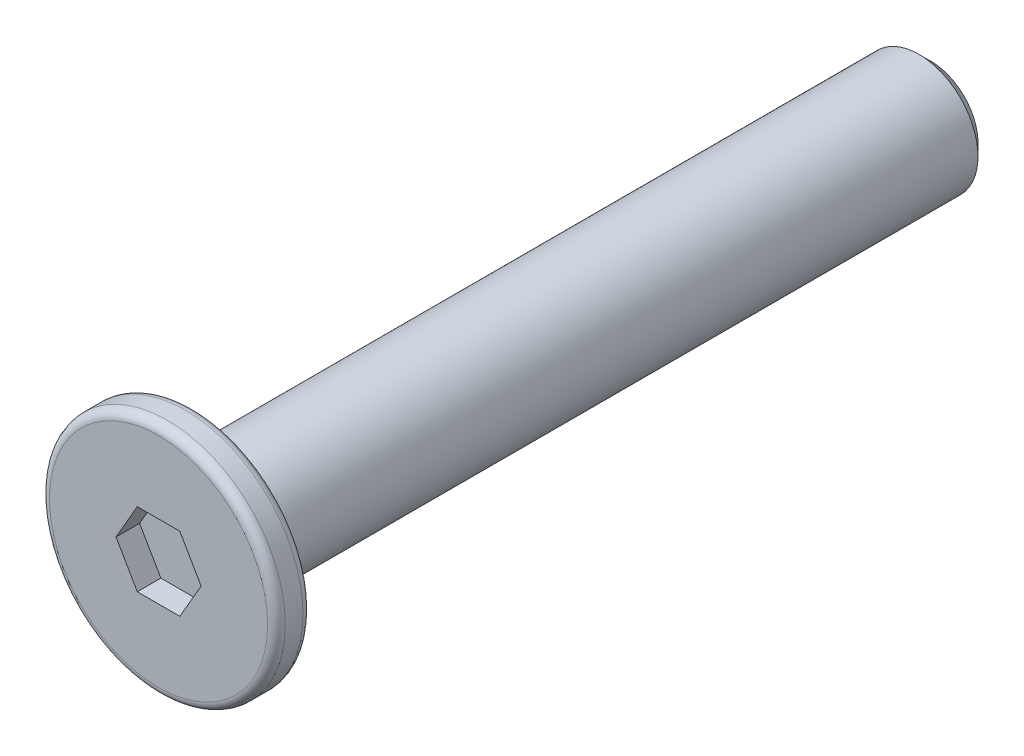
from build123d import *

# Parameters (mm, degrees)
SKETCH_1_R          = 4
EXTRUDE_1_DEPTH     = 0.6
SKETCH_2_R          = 2
EXTRUDE_2_DEPTH     = 25
CHAMFER_1_SIZE      = 0.4
CUT_EXTRUDE_1_DEPTH = 0.8
FILLET_2_R          = 0.3


with BuildPart() as part:
    # 草图1 → 凸台-拉伸1 (new, symmetric)
    with BuildSketch(Plane.XY):
        Circle(SKETCH_1_R)
    extrude(amount=EXTRUDE_1_DEPTH, both=True)

    # 草图2 → 凸台-拉伸2 (add)
    with BuildSketch(Plane(origin=(0, 0, -0.6), x_dir=(-1, 0, 0), z_dir=(0, 0, -1))):
        Circle(SKETCH_2_R)
    extrude(amount=EXTRUDE_2_DEPTH)

    # 倒角1
    chamfer_1_edges = [part.edges().sort_by_distance(p)[0] for p in [
        (2, 0, -25.6),
    ]]
    chamfer(chamfer_1_edges, length=CHAMFER_1_SIZE)

    # 草图3 → 切除-拉伸1 (cut)
    with BuildSketch(Plane.XY.offset(0.6)):
        Polygon((1.443375673, 0), (0.721687836, 1.25), (-0.721687836, 1.25), (-1.443375673, 0), (-0.721687836, -1.25), (0.721687836, -1.25), align=None)
    extrude(amount=-CUT_EXTRUDE_1_DEPTH, mode=Mode.SUBTRACT)

    # 圆角2
    fillet_2_edges = [part.edges().sort_by_distance(p)[0] for p in [
        (-4, 0, -0.6),
        (-4, 0, 0.6),
    ]]
    fillet(fillet_2_edges, radius=FILLET_2_R)


solid = part.part
